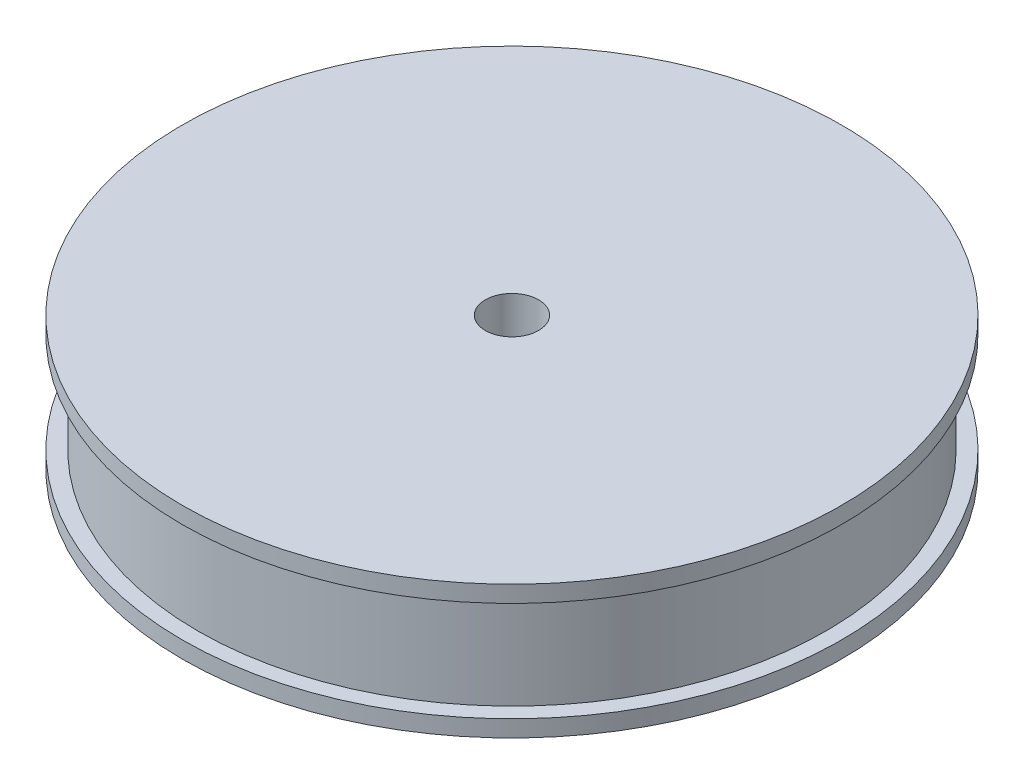
from build123d import *


with BuildPart() as part:
    # Schizzo1 → Rivoluzione1 (revolve)
    with BuildSketch(Plane.XY, mode=Mode.PRIVATE) as rivoluzione1_sk:
        Polygon((4, -7.661290323), (49.5, -7.661290323), (49.5, -5.161290323), (47.175, -5.161290323), (47.175, 9.838709677), (49.5, 9.838709677), (49.5, 12.338709677), (4, 12.338709677), align=None)
    revolve(rivoluzione1_sk.sketch.rotate(Axis((0, 12.338709677, 0), (0, -1, 0)), 90), axis=Axis((0, 12.338709677, 0), (0, -1, 0)))


solid = part.part
